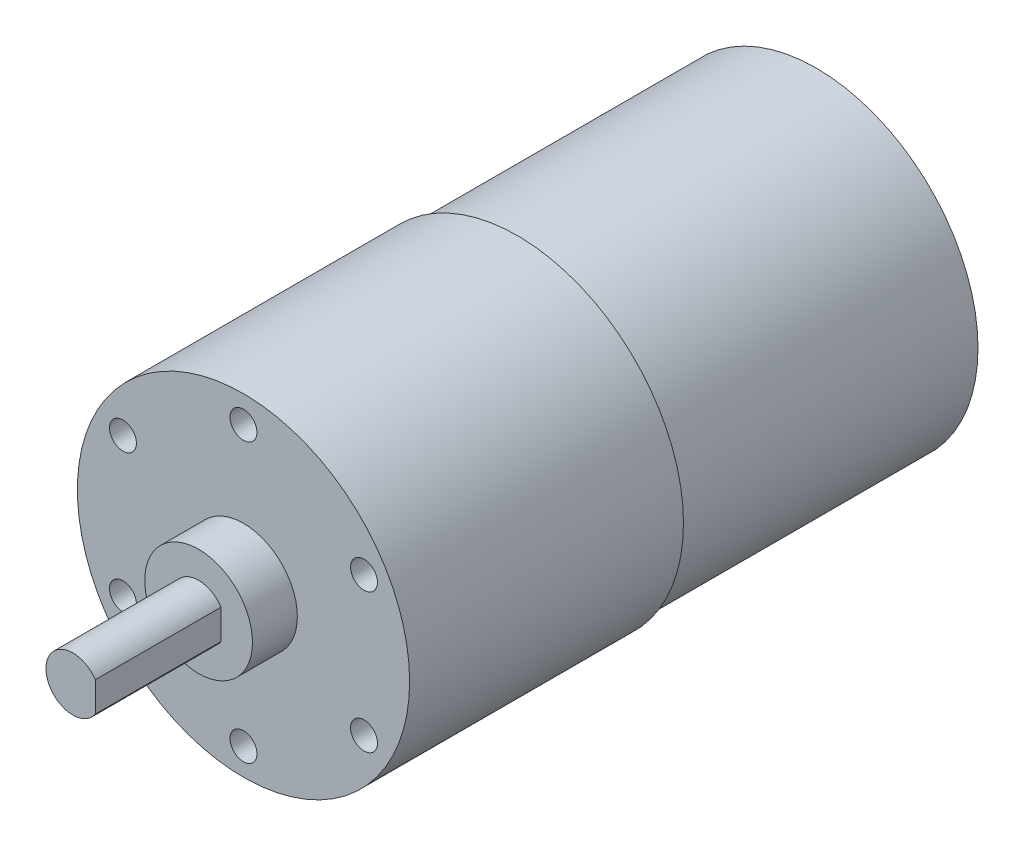
from build123d import *

# Parameters (mm, degrees)
SKETCH_2_R               = 1.5
CUT_EXTRUDE_1_DEPTH      = 10
CUT_EXTRUDE_2_DEPTH      = 87.835131139
CUT_EXTRUDE_2_DEPTH_BACK = 87.835131139
SKETCH_3_W               = 1
SKETCH_3_H               = 14


with BuildPart() as part:
    # 草图1 → 旋转1 (revolve)
    with BuildSketch(Plane(origin=(0, 0, 0), x_dir=(0, 0, -1), z_dir=(1, 0, 0)), mode=Mode.PRIVATE) as revolve_1_sk:
        Polygon((0, 0), (0, 3), (14, 3), (14, 6), (19, 6), (19, 18.5), (49.5, 18.5), (49.5, 18), (82.8, 18), (82.8, 0), align=None)
    revolve(revolve_1_sk.sketch.rotate(Axis((0, 0, 0), (0, 0, -1)), 90), axis=Axis((0, 0, 0), (0, 0, -1)))

    # 草图2 → 切除-拉伸1 (cut)
    with BuildSketch(Plane.XY.offset(-19)):
        with Locations((0, 15.5)):
            Circle(SKETCH_2_R)
        with Locations((13.423393759, 7.75)):
            Circle(SKETCH_2_R)
        with Locations((13.423393759, -7.75)):
            Circle(SKETCH_2_R)
        with Locations((0, -15.5)):
            Circle(SKETCH_2_R)
        with Locations((-13.423393759, -7.75)):
            Circle(SKETCH_2_R)
        with Locations((-13.423393759, 7.75)):
            Circle(SKETCH_2_R)
    extrude(amount=-CUT_EXTRUDE_1_DEPTH, mode=Mode.SUBTRACT)

    # 草图3 → 切除-拉伸2 (cut, two sides: drawn at the far end of the back side and taken through both)
    with BuildSketch(Plane(origin=(0, 0, 0), x_dir=(1, 0, 0), z_dir=(0, 1, 0)).offset(-CUT_EXTRUDE_2_DEPTH_BACK)):
        with Locations((3, 7)):
            Rectangle(SKETCH_3_W, SKETCH_3_H)
    extrude(amount=CUT_EXTRUDE_2_DEPTH + CUT_EXTRUDE_2_DEPTH_BACK, mode=Mode.SUBTRACT)


solid = part.part
